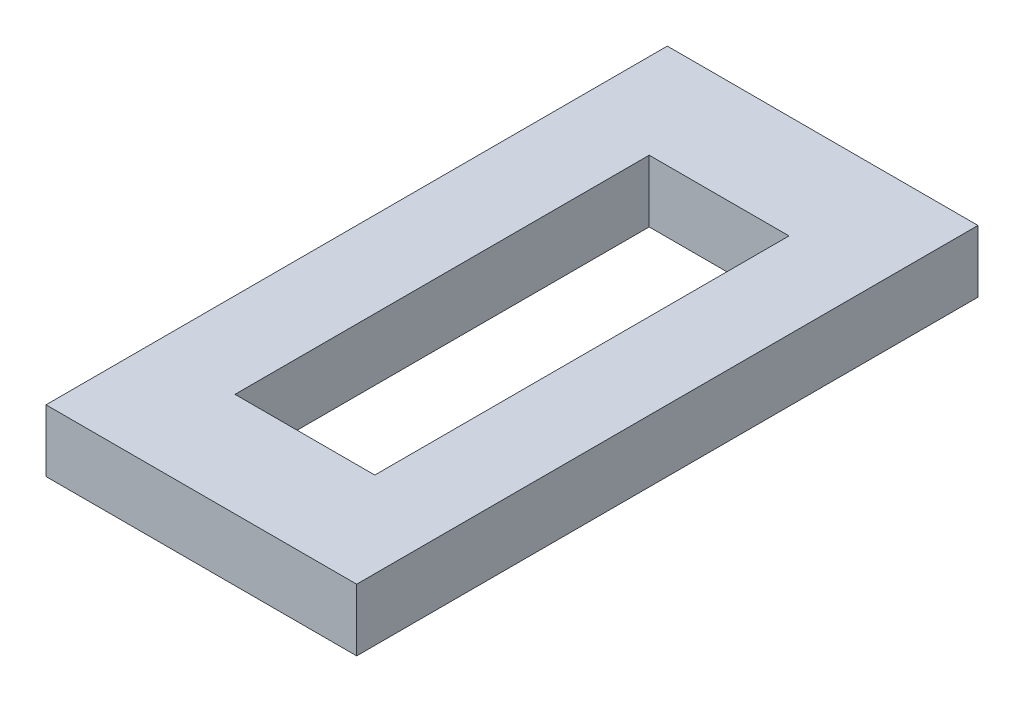
from build123d import *

# Parameters (mm, degrees)
SKETCH1_W           = 30
SKETCH1_H           = 60
SKETCH1_W_2         = 13.5
SKETCH1_H_2         = 40
BOSS_EXTRUDE1_DEPTH = 6


with BuildPart() as part:
    # Sketch1 → Boss-Extrude1 (new body)
    with BuildSketch(Plane(origin=(0, 0, 0), x_dir=(1, 0, 0), z_dir=(0, 1, 0))):
        Rectangle(SKETCH1_W, SKETCH1_H)
        Rectangle(SKETCH1_W_2, SKETCH1_H_2, mode=Mode.SUBTRACT)
    extrude(amount=BOSS_EXTRUDE1_DEPTH)


solid = part.part
